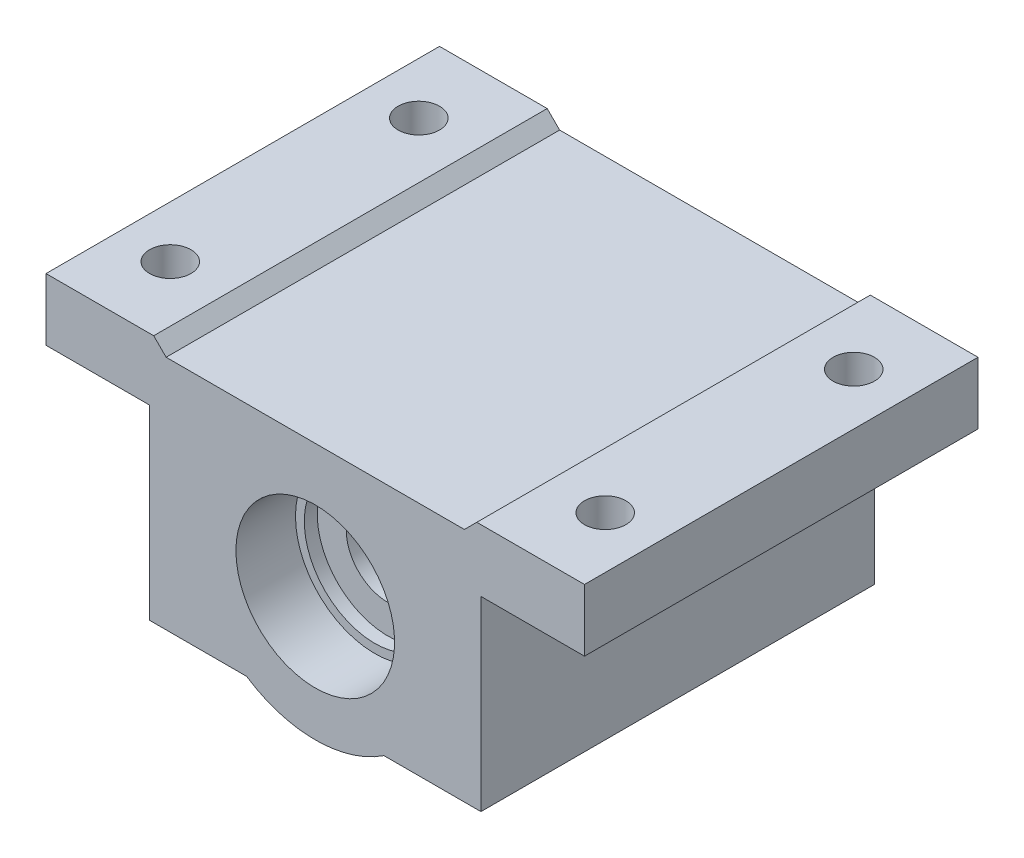
from build123d import *

# Parameters (mm, degrees)
SKETCH1_R            = 6.08076
MAIN_BODY_DEPTH      = 15.08125
SKETCH3_R            = 1.5875
MOUNTING_HOLES_DEPTH = 4.7625
SKETCH8_R            = 6.08076
SKETCH8_R_2          = 3.175
INTERIOR_DEPTH       = 9.525
GROOVES_2_W          = 0.9906
GROOVES_2_H          = 1.35128
GROOVES_2_2_W        = 0.9906
GROOVES_2_2_H        = 1.35128


with BuildPart() as part:
    # Sketch1 → Main Body (new, symmetric)
    with BuildSketch(Plane.XY):
        with BuildLine():
            Line((-12.7, 6.35), (-20.6375, 6.35))
            Line((-20.6375, 6.35), (-20.6375, 11.1125))
            Line((-20.6375, 11.1125), (-12.3825, 11.1125))
            Line((-12.3825, 11.1125), (-11.43, 10.16))
            Line((-11.43, 10.16), (11.43, 10.16))
            Line((11.43, 10.16), (12.3825, 11.1125))
            Line((12.3825, 11.1125), (20.6375, 11.1125))
            Line((20.6375, 11.1125), (20.6375, 6.35))
            Line((20.6375, 6.35), (12.7, 6.35))
            Line((12.7, 6.35), (12.7, -7.9375))
            Line((12.7, -7.9375), (5.265141855, -7.9375))
            ThreePointArc((5.265141855, -7.9375), (0, -9.525), (-5.265141855, -7.9375))
            Line((-5.265141855, -7.9375), (-12.7, -7.9375))
            Line((-12.7, -7.9375), (-12.7, 6.35))
        make_face()
        with Locations(Location((0, 0, 0), (0, 0, 180))):
            Circle(SKETCH1_R, mode=Mode.SUBTRACT)
    extrude(amount=MAIN_BODY_DEPTH, both=True)

    # Sketch3 → Mounting Holes (cut)
    with BuildSketch(Plane(origin=(0, 11.1125, 0), x_dir=(1, 0, 0), z_dir=(0, 1, 0))):
        with Locations(Location((-16.66875, 9.525, 0), (0, 0, 270))):
            Circle(SKETCH3_R)
        with Locations(Location((16.66875, 9.525, 0), (0, 0, 270))):
            Circle(SKETCH3_R)
        with Locations(Location((16.66875, -9.525, 0), (0, 0, 270))):
            Circle(SKETCH3_R)
        with Locations(Location((-16.66875, -9.525, 0), (0, 0, 270))):
            Circle(SKETCH3_R)
    extrude(amount=-MOUNTING_HOLES_DEPTH, mode=Mode.SUBTRACT)

    # Grooves 2 → Grooves (revolve, cut)
    with BuildSketch(Plane(origin=(0, 0, 0), x_dir=(0, 0, -1), z_dir=(1, 0, 0)), mode=Mode.PRIVATE) as grooves_sk:
        with Locations((10.0203, -6.08076)):
            Rectangle(GROOVES_2_W, GROOVES_2_H)
        with Locations((-10.0203, -6.08076)):
            Rectangle(GROOVES_2_W, GROOVES_2_H)
    revolve(grooves_sk.sketch.rotate(Axis((0, 0, 9.525), (0, 0, -1)), 90), axis=Axis((0, 0, 9.525), (0, 0, -1)), mode=Mode.SUBTRACT)


with BuildPart() as body_2:
    # Sketch8 → Interior (new, symmetric)
    with BuildSketch(Plane.XY):
        with Locations(Location((0, 0, 0), (0, 0, 180))):
            Circle(SKETCH8_R)
        with Locations(Location((0, 0, 0), (0, 0, 180))):
            Circle(SKETCH8_R_2, mode=Mode.SUBTRACT)
    extrude(amount=INTERIOR_DEPTH, both=True)


with BuildPart() as body_3:
    # Grooves_2 2 → Retaining Ring (revolve)
    with BuildSketch(Plane(origin=(0, 0, 0), x_dir=(0, 0, -1), z_dir=(1, 0, 0)), mode=Mode.PRIVATE) as retaining_ring_sk:
        with Locations((10.0203, -6.08076)):
            Rectangle(GROOVES_2_2_W, GROOVES_2_2_H)
        with Locations((-10.0203, -6.08076)):
            Rectangle(GROOVES_2_2_W, GROOVES_2_2_H)
    revolve(retaining_ring_sk.sketch.rotate(Axis((0, 0, 9.525), (0, 0, -1)), 270), axis=Axis((0, 0, 9.525), (0, 0, -1)))


solid = Compound([part.part, body_2.part, body_3.part])
